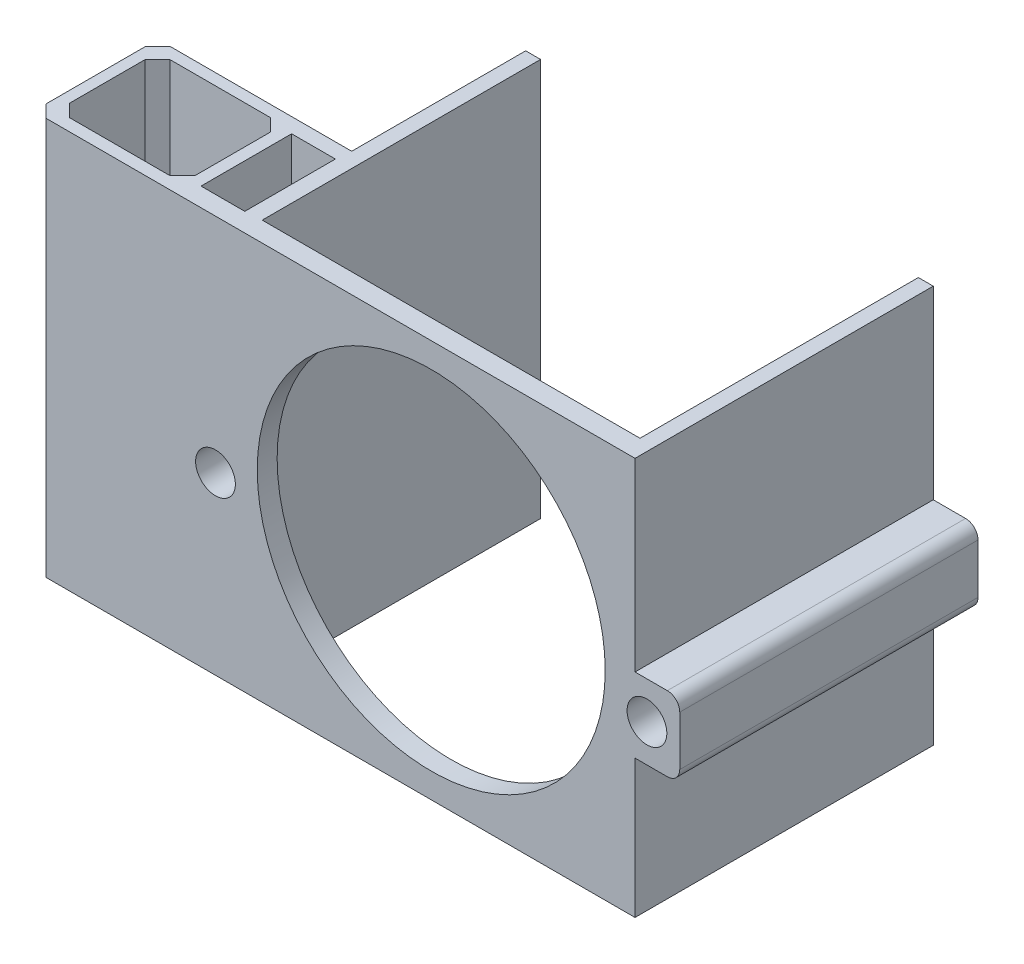
from build123d import *

# Parameters (mm, degrees)
SKETCH_1_W          = 40
SKETCH_1_H          = 32
SKETCH_1_R          = 14
SKETCH_1_R_2        = 1.6
EXTRUDE_1_DEPTH     = 24
SKETCH_3_W          = 30.4
SKETCH_3_H          = 51.000805287
CUT_EXTRUDE_2_DEPTH = 22.4
SKETCH_4_W          = 6.12991639
SKETCH_4_H          = 19.114193836
CUT_EXTRUDE_3_DEPTH = 57.568542495
FILLET_1_R          = 1
SKETCH_6_W          = 15.6
SKETCH_6_H          = 32
EXTRUDE_3_DEPTH     = 10
SKETCH_8_R          = 1.6
CUT_EXTRUDE_4_DEPTH = 66.604877867
CUT_EXTRUDE_5_DEPTH = 66.604877867
CHAMFER_1_SIZE      = 1
SKETCH_10_W         = 3.521220791
SKETCH_10_H         = 7.290414878
CUT_EXTRUDE_6_DEPTH = 15
SKETCH_11_W         = 3.883261803
SKETCH_11_H         = 7.637577492
CUT_EXTRUDE_7_DEPTH = 11


with BuildPart() as part:
    # 草图1 → 凸台-拉伸1 (new body)
    with BuildSketch(Plane.XY):
        with Locations((-20, 16)):
            Rectangle(SKETCH_1_W, SKETCH_1_H)
        with Locations((-20, 16)):
            Circle(SKETCH_1_R, mode=Mode.SUBTRACT)
        with Locations((-2.64, 14.11)):
            Circle(SKETCH_1_R_2, mode=Mode.SUBTRACT)
        with Locations(Location((-37.36, 14.11, 0), (0, 0, 180))):
            Circle(SKETCH_1_R_2, mode=Mode.SUBTRACT)
    extrude(amount=EXTRUDE_1_DEPTH)

    # 草图3 → 切除-拉伸2 (cut)
    with BuildSketch(Plane(origin=(0, 0, 0), x_dir=(-1, 0, 0), z_dir=(0, 0, -1))):
        with Locations((20, 12.05288799)):
            Rectangle(SKETCH_3_W, SKETCH_3_H)
    extrude(amount=-CUT_EXTRUDE_2_DEPTH, mode=Mode.SUBTRACT)

    # 草图4 → 切除-拉伸3 (cut, through all)
    with BuildSketch(Plane(origin=(0, 0, 0), x_dir=(-1, 0, 0), z_dir=(0, 0, -1))):
        with Locations((0.535041805, 26.667096918)):
            Rectangle(SKETCH_4_W, SKETCH_4_H)
        with Locations((39.464958195, 26.667096918)):
            Rectangle(SKETCH_4_W, SKETCH_4_H)
        with Locations((39.464958195, 1.552903082)):
            Rectangle(SKETCH_4_W, SKETCH_4_H)
        with Locations((0.535041805, 1.552903082)):
            Rectangle(SKETCH_4_W, SKETCH_4_H)
    extrude(amount=-CUT_EXTRUDE_3_DEPTH, mode=Mode.SUBTRACT)

    # 圆角1
    fillet_1_edges = [part.edges().sort_by_distance(p)[0] for p in [
        (0, 11.11, 12),
        (0, 17.11, 12),
        (-40, 17.11, 12),
        (-40, 11.11, 12),
    ]]
    fillet(fillet_1_edges, radius=FILLET_1_R)

    # 草图6 → 凸台-拉伸3 (add)
    with BuildSketch(Plane.XY.offset(24)):
        with Locations((-44.2, 16)):
            Rectangle(SKETCH_6_W, SKETCH_6_H)
    extrude(amount=-EXTRUDE_3_DEPTH)

    # 草图8 → 切除-拉伸4 (cut, through all)
    with BuildSketch(Plane.XY.offset(24)):
        with Locations(Location((-37.36, 14.11, 0), (0, 0, 180))):
            Circle(SKETCH_8_R)
    extrude(amount=-CUT_EXTRUDE_4_DEPTH, mode=Mode.SUBTRACT)

    # 草图9 → 切除-拉伸5 (cut, through all)
    with BuildSketch(Plane(origin=(0, 32, 0), x_dir=(1, 0, 0), z_dir=(0, 1, 0))):
        Polygon((-51.102484963, -15.923925167), (-50.102484963, -14.923925167), (-42.006912692, -14.923925167), (-41.006912692, -15.923925167), (-41.006912692, -22.012190671), (-42.006912692, -23.012190671), (-50.102484963, -23.012190671), (-51.102484963, -22.012190671), align=None)
    extrude(amount=-CUT_EXTRUDE_5_DEPTH, mode=Mode.SUBTRACT)

    # 倒角1
    chamfer_1_edges = [part.edges().sort_by_distance(p)[0] for p in [
        (-52, 16, 24),
        (-52, 16, 14),
    ]]
    chamfer(chamfer_1_edges, length=CHAMFER_1_SIZE)

    # 草图10 → 切除-拉伸6 (cut)
    with BuildSketch(Plane(origin=(0, 32, 0), x_dir=(1, 0, 0), z_dir=(0, 1, 0))):
        with Locations((-38.274678112, -18.844062947)):
            Rectangle(SKETCH_10_W, SKETCH_10_H)
    extrude(amount=-CUT_EXTRUDE_6_DEPTH, mode=Mode.SUBTRACT)

    # 草图11 → 切除-拉伸7 (cut)
    with BuildSketch(Plane.XZ):
        with Locations((-38.341630902, 19.067238913)):
            Rectangle(SKETCH_11_W, SKETCH_11_H)
    extrude(amount=-CUT_EXTRUDE_7_DEPTH, mode=Mode.SUBTRACT)


solid = part.part
